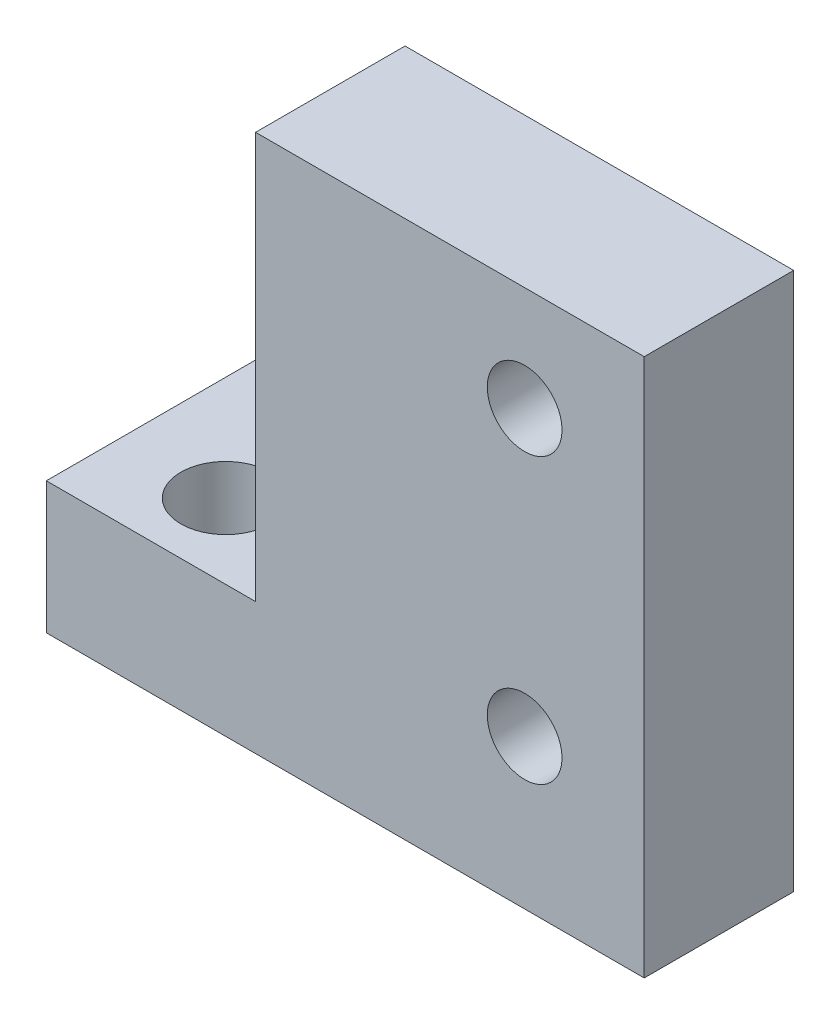
from build123d import *

# Parameters (mm, degrees)
BOSS_EXTRUDE1_DEPTH             = 18
SKETCH2_W                       = 6
SKETCH2_H                       = 13.595638642
CUT_EXTRUDE1_DEPTH              = 10
SKETCH3_W                       = 7
SKETCH3_H                       = 13.595638642
CUT_EXTRUDE2_DEPTH              = 10
SKETCH4_R                       = 1.5
CUT_EXTRUDE3_DEPTH              = 10
TAP_DRILL_FOR_M3X0_5_TAP1_D     = 3
TAP_DRILL_FOR_M3X0_5_TAP1_DEPTH = 5
F_2_5_2_5_DIAMETER_HOLE1_D      = 2.5
F_2_5_2_5_DIAMETER_HOLE1_DEPTH  = 6.5


with BuildPart() as part:
    # Sketch1 → Boss-Extrude1 (new body)
    with BuildSketch(Plane(origin=(0, 0, 0), x_dir=(1, 0, 0), z_dir=(0, 1, 0))):
        Polygon((0, 0), (0, 6), (-7, 6), (-7, -5), (13, -5), (13, 0), align=None)
    extrude(amount=BOSS_EXTRUDE1_DEPTH)

    # Sketch2 → Cut-Extrude1 (cut)
    with BuildSketch(Plane(origin=(0, 0, 0), x_dir=(0, 0, -1), z_dir=(1, 0, 0))):
        with Locations((3, 11.202180679)):
            Rectangle(SKETCH2_W, SKETCH2_H)
    extrude(amount=-CUT_EXTRUDE1_DEPTH, mode=Mode.SUBTRACT)

    # Sketch3 → Cut-Extrude2 (cut)
    with BuildSketch(Plane(origin=(0, 0, 0), x_dir=(-1, 0, 0), z_dir=(0, 0, -1))):
        with Locations((3.5, 11.202180679)):
            Rectangle(SKETCH3_W, SKETCH3_H)
    extrude(amount=-CUT_EXTRUDE2_DEPTH, mode=Mode.SUBTRACT)

    # Sketch4 → Cut-Extrude3 (cut)
    with BuildSketch(Plane.XZ):
        with Locations((-1, -2.2)):
            Circle(SKETCH4_R)
    extrude(amount=-CUT_EXTRUDE3_DEPTH, mode=Mode.SUBTRACT)

    # Tap Drill for M3x0.5 Tap1
    with Locations(Plane(origin=(0, 0, 0), x_dir=(-1, 0, 0), z_dir=(0, -1, 0))):
        with Locations((-3.3, -2.5), (3.5, -2.5)):
            Hole(TAP_DRILL_FOR_M3X0_5_TAP1_D / 2, depth=TAP_DRILL_FOR_M3X0_5_TAP1_DEPTH)

    # Ø2.5 (2.5) Diameter Hole1
    with Locations(Plane(origin=(0, 0, 0), x_dir=(-1, 0, 0), z_dir=(0, 0, -1))):
        with Locations((-9, 14.5), (-9, 5)):
            Hole(F_2_5_2_5_DIAMETER_HOLE1_D / 2, depth=F_2_5_2_5_DIAMETER_HOLE1_DEPTH)


solid = part.part
